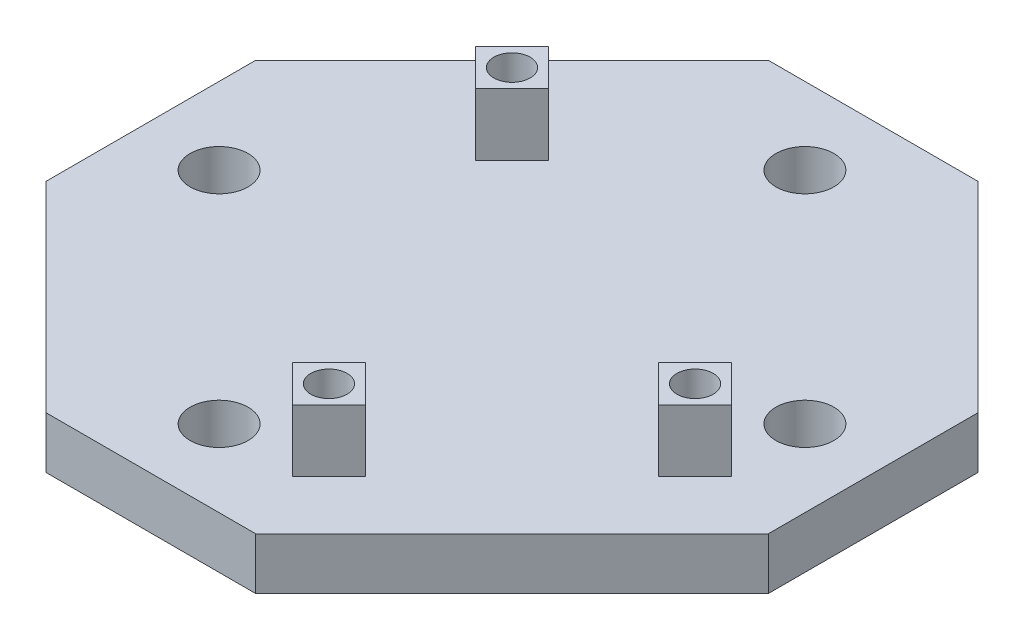
from build123d import *

# Parameters (mm, degrees)
SKETCH1_R               = 2.8
BOSS_EXTRUDE1_DEPTH     = 5
CUT_EXTRUDE1_DEPTH      = 16
CUT_EXTRUDE1_DEPTH_BACK = 10
SKETCH2_R               = 1.75
CUT_EXTRUDE2_DEPTH      = 3.5
BOSS_EXTRUDE2_DEPTH     = 6
SKETCH5_R               = 1.75
CUT_EXTRUDE3_DEPTH      = 58.313311378


with BuildPart() as part:
    # Sketch1 → Boss-Extrude1 (new body)
    with BuildSketch(Plane(origin=(0, 0, 0), x_dir=(1, 0, 0), z_dir=(0, 1, 0))):
        Polygon((-40.303943114, 15.555205773), (-15.555205773, 40.303943114), (4.694794227, 40.303943114), (24.042773974, 20.955963368), (24.042773974, 0.705963368), (-0.705963368, -24.042773974), (-20.955963368, -24.042773974), (-40.303943114, -4.694794227), align=None)
        with Locations(Location((-11.666118476, -16.618152771, 0), (0, 0, 270))):
            Circle(SKETCH1_R, mode=Mode.SUBTRACT)
        with Locations(Location((16.618152771, 11.666118476, 0), (0, 0, 270))):
            Circle(SKETCH1_R, mode=Mode.SUBTRACT)
        with Locations(Location((-4.595050664, 32.879321912, 0), (0, 0, 270))):
            Circle(SKETCH1_R, mode=Mode.SUBTRACT)
        with Locations(Location((-32.879321912, 4.595050664, 0), (0, 0, 270))):
            Circle(SKETCH1_R, mode=Mode.SUBTRACT)
    extrude(amount=BOSS_EXTRUDE1_DEPTH)

    # Sketch2 → Cut-Extrude1 (cut, two sides: drawn at the far end of the back side and taken through both)
    with BuildSketch(Plane(origin=(0, 5, 0), x_dir=(1, 0, 0), z_dir=(0, 1, 0)).offset(-CUT_EXTRUDE1_DEPTH_BACK)):
        with Locations(Location((13.966502342, 3.711167188, 0), (0, 0, 90))):
            Circle(SKETCH2_R)
        with Locations(Location((-3.711167188, -13.966502342, 0), (0, 0, 90))):
            Circle(SKETCH2_R)
        with Locations(Location((-21.31812604, 21.31812604, 0), (0, 0, 90))):
            Circle(SKETCH2_R)
    extrude(amount=CUT_EXTRUDE1_DEPTH + CUT_EXTRUDE1_DEPTH_BACK, mode=Mode.SUBTRACT)

    # Sketch3 → Cut-Extrude2 (cut)
    with BuildSketch(Plane.XZ):
        Polygon((-4.562913887, 10.787740387), (-1.384151932, 11.639487086), (-0.532405234, 14.81824904), (-2.859420489, 17.145264296), (-6.038182444, 16.293517597), (-6.889929142, 13.114755643), align=None)
        Polygon((10.787740387, -4.562913887), (13.114755643, -6.889929142), (16.293517597, -6.038182444), (17.145264296, -2.859420489), (14.81824904, -0.532405234), (11.639487086, -1.384151932), align=None)
        Polygon((-22.169872738, -24.496887994), (-18.991110784, -23.645141295), (-18.139364085, -20.466379341), (-20.466379341, -18.139364085), (-23.645141295, -18.991110784), (-24.496887994, -22.169872738), align=None)
    extrude(amount=-CUT_EXTRUDE2_DEPTH, mode=Mode.SUBTRACT)

    # Sketch4 → Boss-Extrude2 (add)
    with BuildSketch(Plane(origin=(0, 5, 0), x_dir=(1, 0, 0), z_dir=(0, 1, 0))):
        Polygon((-7.246701094, -13.966502342), (-3.711167188, -17.502036248), (-0.175633282, -13.966502342), (-3.711167188, -10.430968436), align=None)
        Polygon((-21.31812604, 17.782592134), (-24.853659945, 21.31812604), (-21.31812604, 24.853659945), (-17.782592134, 21.31812604), align=None)
        Polygon((10.430968436, 3.711167188), (13.966502342, 7.246701094), (17.502036248, 3.711167188), (13.966502342, 0.175633282), align=None)
    extrude(amount=BOSS_EXTRUDE2_DEPTH)

    # Sketch5 → Cut-Extrude3 (cut, through all)
    with BuildSketch(Plane.XZ.offset(-5)):
        with Locations(Location((-21.31812604, -21.31812604, 0), (0, 0, 270))):
            Circle(SKETCH5_R)
        with Locations(Location((-3.711167188, 13.966502342, 0), (0, 0, 270))):
            Circle(SKETCH5_R)
        with Locations(Location((13.966502342, -3.711167188, 0), (0, 0, 270))):
            Circle(SKETCH5_R)
    extrude(amount=-CUT_EXTRUDE3_DEPTH, mode=Mode.SUBTRACT)


solid = part.part
